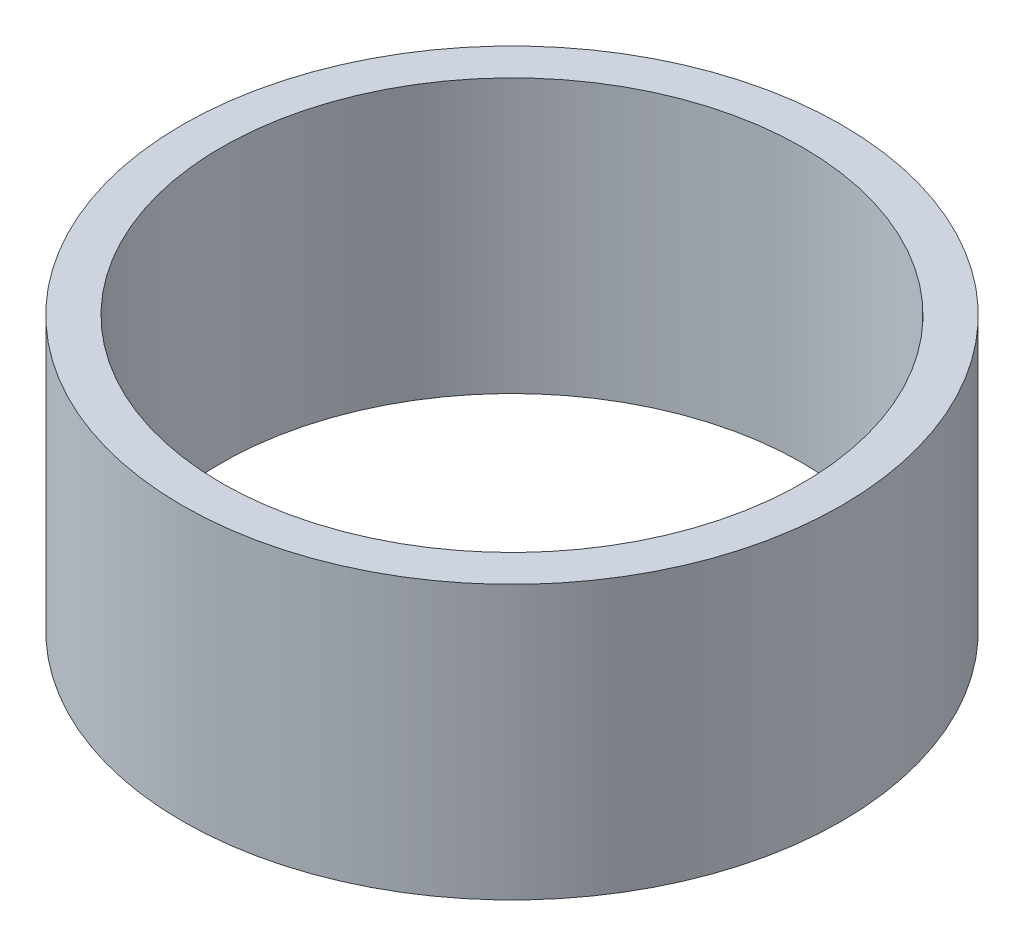
from build123d import *

# Parameters (mm, degrees)
SKETCH1_R           = 42.21365986
SKETCH1_R_2         = 37.21365986
BOSS_EXTRUDE1_DEPTH = 35


with BuildPart() as part:
    # Sketch1 → Boss-Extrude1 (new body)
    with BuildSketch(Plane(origin=(0, 0, 0), x_dir=(1, 0, 0), z_dir=(0, 1, 0))):
        with Locations(Location((0, 0, 0), (0, 0, 270))):
            Circle(SKETCH1_R)
        with Locations(Location((0, 0, 0), (0, 0, 270))):
            Circle(SKETCH1_R_2, mode=Mode.SUBTRACT)
    extrude(amount=BOSS_EXTRUDE1_DEPTH)


solid = part.part
